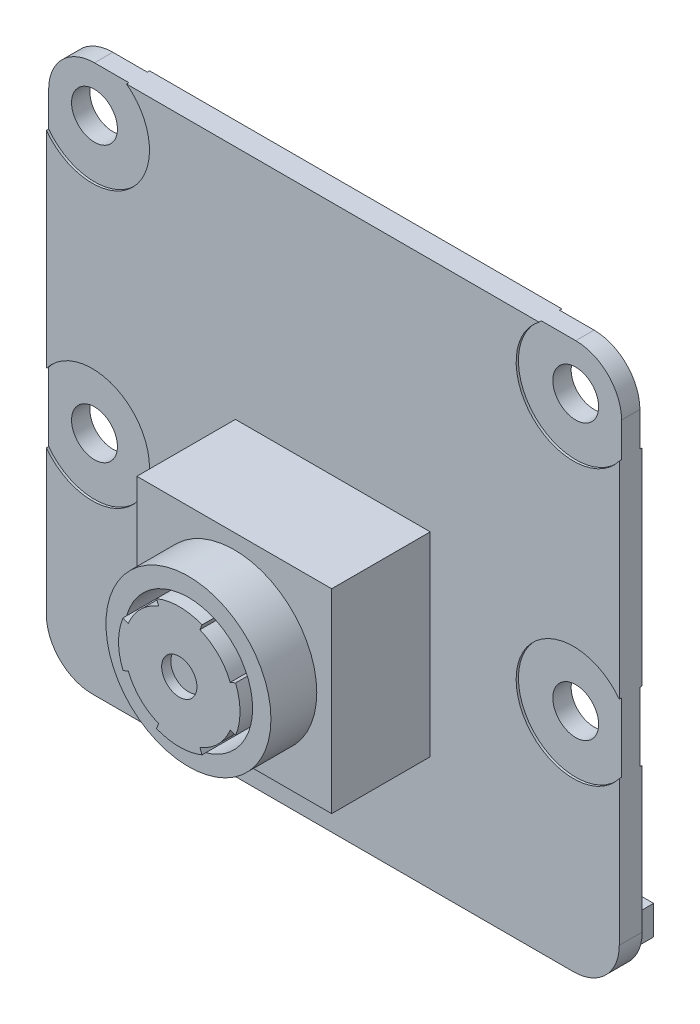
from build123d import *

# Parameters (mm, degrees)
SKETCH_1_R          = 1
EXTRUDE_1_DEPTH     = 1
CUT_EXTRUDE_START   = -0.1
CUT_EXTRUDE_1_DEPTH = 0.1
CUT_EXTRUDE_2_DEPTH = 0.1
SKETCH_2_W          = 8.5
SKETCH_2_H          = 8.5
EXTRUDE_2_DEPTH     = 4.3
SKETCH_3_R          = 3.6
SKETCH_3_R_2        = 2.8
EXTRUDE_3_DEPTH     = 2
SKETCH_4_R          = 0.77
EXTRUDE_4_DEPTH     = 2.4
SKETCH_5_R          = 0.77
EXTRUDE_5_DEPTH     = 2
EXTRUDE_6_DEPTH     = 2


with BuildPart() as part:
    # 草图1 → 凸台-拉伸1 (new body)
    with BuildSketch(Plane.XY):
        with BuildLine():
            Line((2, 0), (23, 0))
            ThreePointArc((23, 0), (24.414213562, 0.585786438), (25, 2))
            Line((25, 2), (25, 21.8))
            ThreePointArc((25, 21.8), (24.414213562, 23.214213562), (23, 23.8))
            Line((23, 23.8), (2, 23.8))
            ThreePointArc((2, 23.8), (0.585786438, 23.214213562), (0, 21.8))
            Line((0, 21.8), (0, 2))
            ThreePointArc((0, 2), (0.585786438, 0.585786438), (2, 0))
        make_face()
        with Locations((23, 21.8)):
            Circle(SKETCH_1_R, mode=Mode.SUBTRACT)
        with Locations(Location((2, 21.8, 0), (0, 0, 180))):
            Circle(SKETCH_1_R, mode=Mode.SUBTRACT)
        with Locations(Location((2, 9.8, 0), (0, 0, 180))):
            Circle(SKETCH_1_R, mode=Mode.SUBTRACT)
        with Locations((23, 9.8)):
            Circle(SKETCH_1_R, mode=Mode.SUBTRACT)
    extrude(amount=EXTRUDE_1_DEPTH)

    # 草图6 → 切除-拉伸1 (cut)
    with BuildSketch(Plane.XY.offset(1).offset(CUT_EXTRUDE_START)):
        with BuildLine():
            Line((25, 20.3), (25, 21.8))
            ThreePointArc((25, 21.8), (24.414213562, 23.214213562), (23, 23.8))
            Line((23, 23.8), (21.5, 23.8))
            ThreePointArc((21.5, 23.8), (21.232233047, 20.032233047), (25, 20.3))
        make_face()
        with BuildLine():
            Line((0, 11.3), (0, 8.3))
            ThreePointArc((0, 8.3), (4.5, 9.8), (0, 11.3))
        make_face()
        with BuildLine():
            Line((3.5, 23.8), (2, 23.8))
            ThreePointArc((2, 23.8), (0.585786438, 23.214213562), (0, 21.8))
            Line((0, 21.8), (0, 20.3))
            ThreePointArc((0, 20.3), (3.767766953, 20.032233047), (3.5, 23.8))
        make_face()
        with BuildLine():
            Line((25, 8.3), (25, 11.3))
            ThreePointArc((25, 11.3), (20.5, 9.8), (25, 8.3))
        make_face()
    extrude(amount=CUT_EXTRUDE_1_DEPTH, mode=Mode.SUBTRACT)

    # 草图7 → 切除-拉伸2 (cut)
    with BuildSketch(Plane(origin=(0, 0, 0), x_dir=(-1, 0, 0), z_dir=(0, 0, -1))):
        with BuildLine():
            Line((-3.5, 23.8), (-2, 23.8))
            ThreePointArc((-2, 23.8), (-0.585786438, 23.214213562), (0, 21.8))
            Line((0, 21.8), (0, 20.3))
            ThreePointArc((0, 20.3), (-3.767766953, 20.032233047), (-3.5, 23.8))
        make_face()
        with BuildLine():
            Line((0, 11.3), (0, 8.3))
            ThreePointArc((0, 8.3), (-4.5, 9.8), (0, 11.3))
        make_face()
        with BuildLine():
            Line((-25, 8.3), (-25, 11.3))
            ThreePointArc((-25, 11.3), (-20.5, 9.8), (-25, 8.3))
        make_face()
        with BuildLine():
            Line((-23, 23.8), (-21.5, 23.8))
            ThreePointArc((-21.5, 23.8), (-21.232233047, 20.032233047), (-25, 20.3))
            Line((-25, 20.3), (-25, 21.8))
            ThreePointArc((-25, 21.8), (-24.414213562, 23.214213562), (-23, 23.8))
        make_face()
    extrude(amount=-CUT_EXTRUDE_2_DEPTH, mode=Mode.SUBTRACT)

    # 草图2 → 凸台-拉伸2 (add)
    with BuildSketch(Plane.XY.offset(1)):
        with Locations((12.5, 9.25)):
            Rectangle(SKETCH_2_W, SKETCH_2_H)
    extrude(amount=EXTRUDE_2_DEPTH)

    # 草图3 → 凸台-拉伸3 (add)
    with BuildSketch(Plane.XY.offset(5.3)):
        with Locations((12.5, 9.25)):
            Circle(SKETCH_3_R)
        with Locations((12.5, 9.25)):
            Circle(SKETCH_3_R_2, mode=Mode.SUBTRACT)
    extrude(amount=EXTRUDE_3_DEPTH)

    # 草图4 → 凸台-拉伸4 (add)
    with BuildSketch(Plane.XY.offset(5.3)):
        with BuildLine():
            Line((11.50625, 11.706615749), (11.6, 11.474859546))
            ThreePointArc((11.6, 11.474859546), (10.802943725, 10.947056275), (10.275140454, 10.15))
            Line((10.275140454, 10.15), (10.043384251, 10.24375))
            ThreePointArc((10.043384251, 10.24375), (9.85, 9.25), (10.043384251, 8.25625))
            Line((10.043384251, 8.25625), (10.275140454, 8.35))
            ThreePointArc((10.275140454, 8.35), (10.802943725, 7.552943725), (11.6, 7.025140454))
            Line((11.6, 7.025140454), (11.50625, 6.793384251))
            ThreePointArc((11.50625, 6.793384251), (12.5, 6.6), (13.49375, 6.793384251))
            Line((13.49375, 6.793384251), (13.4, 7.025140454))
            ThreePointArc((13.4, 7.025140454), (14.197056275, 7.552943725), (14.724859546, 8.35))
            Line((14.724859546, 8.35), (14.956615749, 8.25625))
            ThreePointArc((14.956615749, 8.25625), (15.15, 9.25), (14.956615749, 10.24375))
            Line((14.956615749, 10.24375), (14.724859546, 10.15))
            ThreePointArc((14.724859546, 10.15), (14.197056275, 10.947056275), (13.4, 11.474859546))
            Line((13.4, 11.474859546), (13.49375, 11.706615749))
            ThreePointArc((13.49375, 11.706615749), (12.5, 11.9), (11.50625, 11.706615749))
        make_face()
        with Locations((12.5, 9.25)):
            Circle(SKETCH_4_R, mode=Mode.SUBTRACT)
    extrude(amount=EXTRUDE_4_DEPTH)

    # 草图5 → 凸台-拉伸5 (add)
    with BuildSketch(Plane.XY.offset(5.3)):
        with Locations((12.5, 9.25)):
            Circle(SKETCH_5_R)
    extrude(amount=EXTRUDE_5_DEPTH)


with BuildPart() as body_2:
    # 草图8 → 凸台-拉伸6 (new body)
    with BuildSketch(Plane(origin=(0, 0, 0), x_dir=(-1, 0, 0), z_dir=(0, 0, -1))):
        with BuildLine():
            ThreePointArc((-23.5, 0.063508327), (-23.252008585, 0.015940607), (-23, 0))
            Line((-23, 0), (-12.5, 0))
            Line((-12.5, 0), (-12.5, 5))
            Line((-12.5, 5), (-22.75, 5))
            Line((-22.75, 5), (-22.75, 1.335560583))
            Line((-22.75, 1.335560583), (-23.5, 1.335560583))
            Line((-23.5, 1.335560583), (-23.5, 0.063508327))
        make_face()
        with BuildLine():
            Line((-12.5, 5), (-12.5, 0))
            Line((-12.5, 0), (-2, 0))
            ThreePointArc((-2, 0), (-1.747991415, 0.015940607), (-1.5, 0.063508327))
            Line((-1.5, 0.063508327), (-1.5, 1.335560583))
            Line((-1.5, 1.335560583), (-2.25, 1.335560583))
            Line((-2.25, 1.335560583), (-2.25, 5))
            Line((-2.25, 5), (-12.5, 5))
        make_face()
    extrude(amount=EXTRUDE_6_DEPTH)


solid = Compound([part.part, body_2.part])
